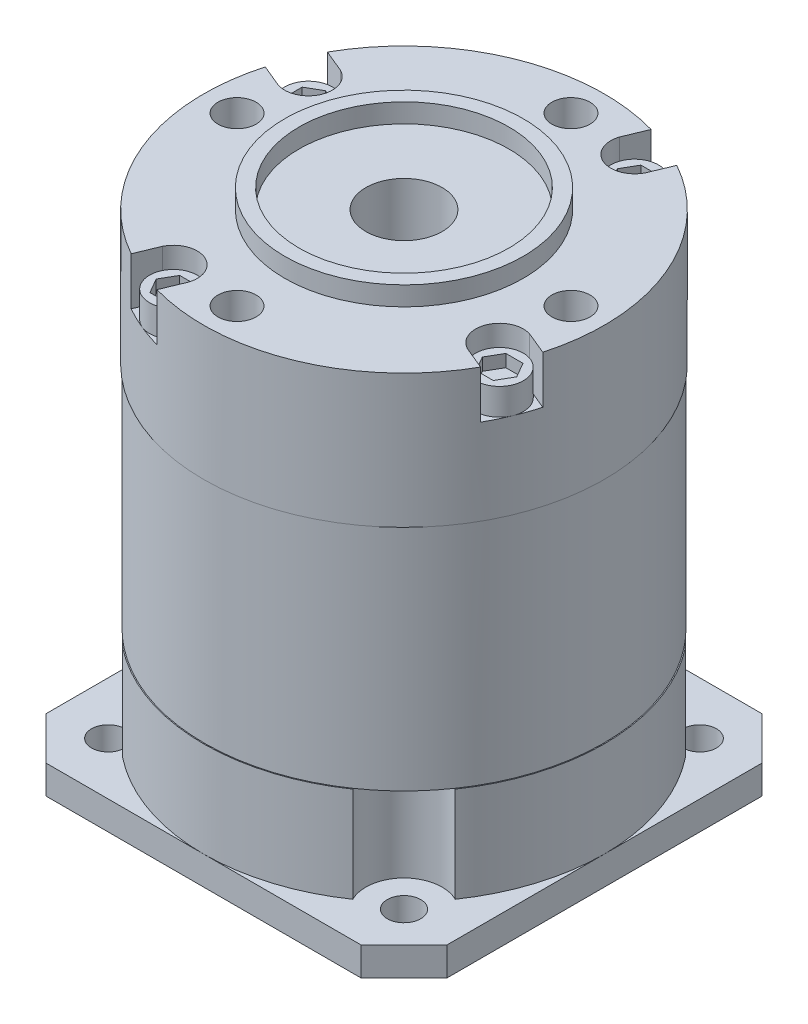
from build123d import *

# Parameters (mm, degrees)
SKETCH_1_W           = 42
SKETCH_1_H           = 42
EXTRUDE_1_DEPTH      = 3
CUT_EXTRUDE_START    = 3
CUT_EXTRUDE_1_DEPTH  = 3
SKETCH_3_R           = 21
EXTRUDE_2_DEPTH      = 51
SKETCH_5_R           = 1.75
CUT_EXTRUDE_3_DEPTH  = 3
SKETCH_7_R           = 2.75
SKETCH_7_R_2         = 4
CUT_EXTRUDE_4_DEPTH  = 10
CUT_EXTRUDE_START_2  = 13
SKETCH_8_R           = 21
SKETCH_8_R_2         = 20.9
CUT_EXTRUDE_5_DEPTH  = 24
EXTRUDE_START        = 51
SKETCH_9_R           = 12.5
EXTRUDE_3_DEPTH      = 2
CUT_EXTRUDE_START_3  = 53
SKETCH_16_R          = 11
CUT_EXTRUDE_6_DEPTH  = 2
CUT_EXTRUDE_START_4  = 46
CUT_EXTRUDE_7_DEPTH  = 5
EXTRUDE_START_2      = 46
SKETCH_18_R          = 2.5
EXTRUDE_5_DEPTH      = 2.8
SKETCH_19_R          = 4
CUT_EXTRUDE_8_DEPTH  = 51
EXTRUDE_6_DEPTH      = 1.5
SKETCH_21_R          = 12.5
CUT_EXTRUDE_9_DEPTH  = 3
CUT_EXTRUDE_START_5  = 51
SKETCH_11_R          = 2
CUT_EXTRUDE_11_DEPTH = 8


with BuildPart() as part:
    # 草图1 → 凸台-拉伸1 (new body)
    with BuildSketch(Plane(origin=(0, 0, 0), x_dir=(1, 0, 0), z_dir=(0, 1, 0))):
        Rectangle(SKETCH_1_W, SKETCH_1_H)
    extrude(amount=EXTRUDE_1_DEPTH)

    # 草图2 → 切除-拉伸1 (cut)
    with BuildSketch(Plane(origin=(0, 0, 0), x_dir=(1, 0, 0), z_dir=(0, 1, 0)).offset(CUT_EXTRUDE_START)):
        Polygon((-21, 21), (-21, 16.5), (-16.5, 21), align=None)
        Polygon((16.5, 21), (21, 21), (21, 16.5), align=None)
        Polygon((21, -21), (21, -16.5), (16.5, -21), align=None)
        Polygon((-16.5, -21), (-21, -21), (-21, -16.5), align=None)
    extrude(amount=-CUT_EXTRUDE_1_DEPTH, mode=Mode.SUBTRACT)

    # 草图3 → 凸台-拉伸2 (add)
    with BuildSketch(Plane(origin=(0, 0, 0), x_dir=(1, 0, 0), z_dir=(0, 1, 0))):
        with Locations(Location((0, 0, 0), (0, 0, 270))):
            Circle(SKETCH_3_R)
    extrude(amount=EXTRUDE_2_DEPTH)

    # 草图5 → 切除-拉伸3 (cut)
    with BuildSketch(Plane(origin=(0, 0, 0), x_dir=(1, 0, 0), z_dir=(0, 1, 0))):
        with Locations(Location((-15.5, 15.5, 0), (0, 0, 11.30517652))):
            Circle(SKETCH_5_R)
        with Locations(Location((15.5, 15.5, 0), (0, 0, 168.69482348))):
            Circle(SKETCH_5_R)
        with Locations(Location((-15.5, -15.5, 0), (0, 0, 101.30517652))):
            Circle(SKETCH_5_R)
        with Locations(Location((15.5, -15.5, 0), (0, 0, 78.69482348))):
            Circle(SKETCH_5_R)
    extrude(amount=CUT_EXTRUDE_3_DEPTH, mode=Mode.SUBTRACT)

    # 草图7 → 切除-拉伸4 (cut)
    with BuildSketch(Plane(origin=(0, 0, 0), x_dir=(1, 0, 0), z_dir=(0, 1, 0)).offset(CUT_EXTRUDE_START)):
        with Locations((-15.5, 15.5)):
            Circle(SKETCH_7_R)
        with Locations((15.5, 15.5)):
            Circle(SKETCH_7_R)
        with Locations((-15.5, -15.5)):
            Circle(SKETCH_7_R)
        with Locations((15.5, -15.5)):
            Circle(SKETCH_7_R_2)
    extrude(amount=CUT_EXTRUDE_4_DEPTH, mode=Mode.SUBTRACT)

    # 草图8 → 切除-拉伸5 (cut)
    with BuildSketch(Plane(origin=(0, 0, 0), x_dir=(1, 0, 0), z_dir=(0, 1, 0)).offset(CUT_EXTRUDE_START_2)):
        with Locations(Location((0, 0, 0), (0, 0, 270))):
            Circle(SKETCH_8_R)
        with Locations(Location((0, 0, 0), (0, 0, 51.840009715))):
            Circle(SKETCH_8_R_2, mode=Mode.SUBTRACT)
    extrude(amount=CUT_EXTRUDE_5_DEPTH, mode=Mode.SUBTRACT)

    # 草图9 → 凸台-拉伸3 (add)
    with BuildSketch(Plane(origin=(0, 0, 0), x_dir=(1, 0, 0), z_dir=(0, 1, 0)).offset(EXTRUDE_START)):
        with Locations(Location((0, 0, 0), (0, 0, 270))):
            Circle(SKETCH_9_R)
    extrude(amount=EXTRUDE_3_DEPTH)

    # 草图16 → 切除-拉伸6 (cut)
    with BuildSketch(Plane(origin=(0, 0, 0), x_dir=(1, 0, 0), z_dir=(0, 1, 0)).offset(CUT_EXTRUDE_START_3)):
        with Locations(Location((0, 0, 0), (0, 0, 270))):
            Circle(SKETCH_16_R)
    extrude(amount=-CUT_EXTRUDE_6_DEPTH, mode=Mode.SUBTRACT)

    # 草图17 → 切除-拉伸7 (cut)
    with BuildSketch(Plane(origin=(0, 0, 0), x_dir=(1, 0, 0), z_dir=(0, 1, 0)).offset(CUT_EXTRUDE_START_4)):
        with BuildLine():
            Line((16.293309868, -9.448706448), (18.309607443, -10.28388425))
            ThreePointArc((18.309607443, -10.28388425), (19.401470183, -8.03635208), (20.218651874, -5.675043294))
            Line((20.218651874, -5.675043294), (18.202354299, -4.839865492))
            Line((18.202354299, -4.839865492), (17.890232835, -4.710580549))
            ThreePointArc((17.890232835, -4.710580549), (14.78207252, -6.122934918), (15.981188404, -9.319421505))
            Line((15.981188404, -9.319421505), (16.293309868, -9.448706448))
        make_face()
        with BuildLine():
            Line((-4.839865492, -18.202354299), (-4.710580549, -17.890232835))
            ThreePointArc((-4.710580549, -17.890232835), (-6.122934918, -14.78207252), (-9.319421505, -15.981188404))
            Line((-9.319421505, -15.981188404), (-9.448706448, -16.293309868))
            Line((-9.448706448, -16.293309868), (-10.28388425, -18.309607443))
            ThreePointArc((-10.28388425, -18.309607443), (-8.03635208, -19.401470183), (-5.675043294, -20.218651874))
            Line((-5.675043294, -20.218651874), (-4.839865492, -18.202354299))
        make_face()
        with BuildLine():
            Line((-16.293309868, 9.448706448), (-18.309607443, 10.28388425))
            ThreePointArc((-18.309607443, 10.28388425), (-19.401470183, 8.03635208), (-20.218651874, 5.675043294))
            Line((-20.218651874, 5.675043294), (-18.202354299, 4.839865492))
            Line((-18.202354299, 4.839865492), (-17.890232835, 4.710580549))
            ThreePointArc((-17.890232835, 4.710580549), (-14.78207252, 6.122934918), (-15.981188404, 9.319421505))
            Line((-15.981188404, 9.319421505), (-16.293309868, 9.448706448))
        make_face()
        with BuildLine():
            Line((4.839865492, 18.202354299), (4.710580549, 17.890232835))
            ThreePointArc((4.710580549, 17.890232835), (6.122934918, 14.78207252), (9.319421505, 15.981188404))
            Line((9.319421505, 15.981188404), (9.448706448, 16.293309868))
            Line((9.448706448, 16.293309868), (10.28388425, 18.309607443))
            ThreePointArc((10.28388425, 18.309607443), (8.03635208, 19.401470183), (5.675043294, 20.218651874))
            Line((5.675043294, 20.218651874), (4.839865492, 18.202354299))
        make_face()
    extrude(amount=CUT_EXTRUDE_7_DEPTH, mode=Mode.SUBTRACT)

    # 草图18 → 凸台-拉伸5 (add)
    # profile 1 of 4: a face of its own
    with BuildSketch(Plane(origin=(0, 0, 0), x_dir=(1, 0, 0), z_dir=(0, 1, 0)).offset(EXTRUDE_START_2)):
        with Locations((-17.091771351, 7.079643499)):
            Circle(SKETCH_18_R)
        Polygon((-15.532925625, 7.979643499), (-17.091771351, 8.879643499), (-18.650617078, 7.979643499), (-18.650617078, 6.179643499), (-17.091771351, 5.279643499), (-15.532925625, 6.179643499), align=None, mode=Mode.SUBTRACT)
    # profile 2 of 4: a face of its own
    with BuildSketch(Plane(origin=(0, 0, 0), x_dir=(1, 0, 0), z_dir=(0, 1, 0)).offset(EXTRUDE_START_2)):
        with Locations((-7.079643499, -17.091771351)):
            Circle(SKETCH_18_R)
        Polygon((-6.179643499, -18.650617078), (-5.279643499, -17.091771351), (-6.179643499, -15.532925625), (-7.979643499, -15.532925625), (-8.879643499, -17.091771351), (-7.979643499, -18.650617078), align=None, mode=Mode.SUBTRACT)
    # profile 3 of 4: a face of its own
    with BuildSketch(Plane(origin=(0, 0, 0), x_dir=(1, 0, 0), z_dir=(0, 1, 0)).offset(EXTRUDE_START_2)):
        with Locations((17.091771351, -7.079643499)):
            Circle(SKETCH_18_R)
        Polygon((18.891771351, -7.079643499), (17.991771351, -5.520797772), (16.191771351, -5.520797772), (15.291771351, -7.079643499), (16.191771351, -8.638489226), (17.991771351, -8.638489226), align=None, mode=Mode.SUBTRACT)
    # profile 4 of 4: a face of its own
    with BuildSketch(Plane(origin=(0, 0, 0), x_dir=(1, 0, 0), z_dir=(0, 1, 0)).offset(EXTRUDE_START_2)):
        with Locations((7.079643499, 17.091771351)):
            Circle(SKETCH_18_R)
        Polygon((7.979643499, 15.532925625), (8.879643499, 17.091771351), (7.979643499, 18.650617078), (6.179643499, 18.650617078), (5.279643499, 17.091771351), (6.179643499, 15.532925625), align=None, mode=Mode.SUBTRACT)
    extrude(amount=EXTRUDE_5_DEPTH)

    # 草图19 → 切除-拉伸8 (cut)
    with BuildSketch(Plane(origin=(0, 0, 0), x_dir=(1, 0, 0), z_dir=(0, 1, 0))):
        with Locations(Location((0, 0, 0), (0, 0, 270))):
            Circle(SKETCH_19_R)
    extrude(amount=CUT_EXTRUDE_8_DEPTH, mode=Mode.SUBTRACT)

    # 草图20 → 凸台-拉伸6 (add)
    with BuildSketch(Plane(origin=(0, 0, 0), x_dir=(1, 0, 0), z_dir=(0, 1, 0)).offset(EXTRUDE_START_2)):
        Polygon((7.979643499, 18.650617078), (6.179643499, 18.650617078), (5.279643499, 17.091771351), (6.179643499, 15.532925625), (7.979643499, 15.532925625), (8.879643499, 17.091771351), align=None)
        Polygon((16.191771351, -5.520797772), (15.291771351, -7.079643499), (16.191771351, -8.638489226), (17.991771351, -8.638489226), (18.891771351, -7.079643499), (17.991771351, -5.520797772), align=None)
        Polygon((-6.179643499, -15.532925625), (-7.979643499, -15.532925625), (-8.879643499, -17.091771351), (-7.979643499, -18.650617078), (-6.179643499, -18.650617078), (-5.279643499, -17.091771351), align=None)
        Polygon((-18.650617078, 7.979643499), (-18.650617078, 6.179643499), (-17.091771351, 5.279643499), (-15.532925625, 6.179643499), (-15.532925625, 7.979643499), (-17.091771351, 8.879643499), align=None)
    extrude(amount=EXTRUDE_6_DEPTH)

    # 草图21 → 切除-拉伸9 (cut)
    with BuildSketch(Plane(origin=(0, 0, 0), x_dir=(1, 0, 0), z_dir=(0, 1, 0))):
        with Locations(Location((0, 0, 0), (0, 0, 270))):
            Circle(SKETCH_21_R)
    extrude(amount=CUT_EXTRUDE_9_DEPTH, mode=Mode.SUBTRACT)

    # 草图11 → 切除-拉伸11 (cut)
    with BuildSketch(Plane(origin=(0, 0, 0), x_dir=(1, 0, 0), z_dir=(0, 1, 0)).offset(CUT_EXTRUDE_START_5)):
        with Locations(Location((-17.5, 0, 0), (0, 0, 270))):
            Circle(SKETCH_11_R)
        with Locations(Location((0, -17.5, 0), (0, 0, 270))):
            Circle(SKETCH_11_R)
        with Locations(Location((17.5, 0, 0), (0, 0, 270))):
            Circle(SKETCH_11_R)
        with Locations(Location((0, 17.5, 0), (0, 0, 270))):
            Circle(SKETCH_11_R)
    extrude(amount=-CUT_EXTRUDE_11_DEPTH, mode=Mode.SUBTRACT)


solid = part.part
